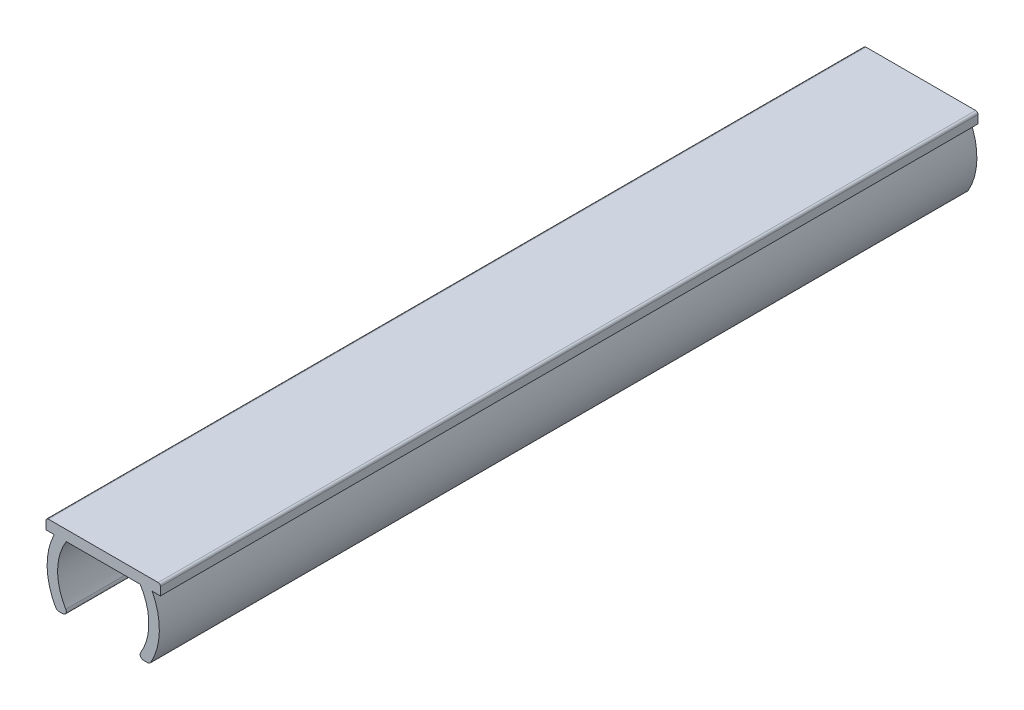
from build123d import *

# Parameters (mm, degrees)
EXTRUDE_1_DEPTH = 70


with BuildPart() as part:
    # 草图1 → 凸台-拉伸1 (new body)
    with BuildSketch(Plane.XY):
        with BuildLine():
            Line((0.2, 0.9), (9.6, 0.9))
            ThreePointArc((9.6, 0.9), (9.741421356, 0.841421356), (9.8, 0.7))
            Line((9.8, 0.7), (9.8, 0))
            Line((9.8, 0), (9.095909231, 0))
            ThreePointArc((9.095909231, 0), (9.703179683, -2.690137412), (8.967513749, -5.348033635))
            ThreePointArc((8.967513749, -5.348033635), (8.857560706, -5.459239359), (8.706580725, -5.5))
            Line((8.706580725, -5.5), (8.358309598, -5.5))
            ThreePointArc((8.358309598, -5.5), (8.096544276, -5.34655687), (8.10255289, -5.043192773))
            ThreePointArc((8.10255289, -5.043192773), (8.804655076, -2.515755891), (8.061784314, 0))
            Line((8.061784314, 0), (1.738215686, 0))
            ThreePointArc((1.738215686, 0), (0.995344924, -2.515755891), (1.69744711, -5.043192773))
            ThreePointArc((1.69744711, -5.043192773), (1.703455724, -5.34655687), (1.441690402, -5.5))
            Line((1.441690402, -5.5), (1.093419275, -5.5))
            ThreePointArc((1.093419275, -5.5), (0.942439294, -5.459239359), (0.832486251, -5.348033635))
            ThreePointArc((0.832486251, -5.348033635), (0.096820317, -2.690137412), (0.704090769, 0))
            Line((0.704090769, 0), (0, 0))
            Line((0, 0), (0, 0.7))
            ThreePointArc((0, 0.7), (0.058578644, 0.841421356), (0.2, 0.9))
        make_face()
    extrude(amount=EXTRUDE_1_DEPTH)


solid = part.part
